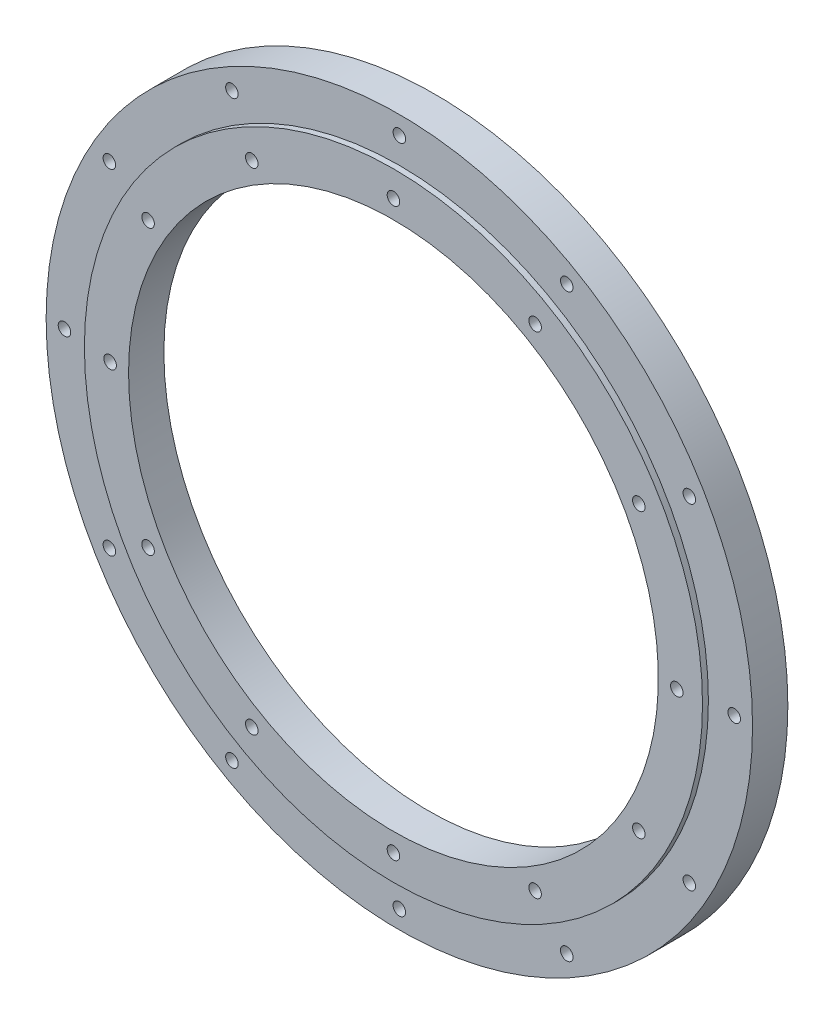
from build123d import *

# Parameters (mm, degrees)
SKETCH2_R             = 76.2
SKETCH2_R_2           = 66.675
BOSS_EXTRUDE1_DEPTH   = 7.62
BOSS_EXTRUDE2_START   = 1.27
SKETCH2_3_R           = 66.675
SKETCH2_3_R_2         = 57.15
BOSS_EXTRUDE2_DEPTH   = 7.62
F_6_32_TAPPED_HOLE1_D = 2.7051
F_6_32_TAPPED_HOLE2_D = 2.7051


with BuildPart() as part:
    # Sketch2 → Boss-Extrude1 (new body)
    with BuildSketch(Plane.XY):
        Circle(SKETCH2_R)
        Circle(SKETCH2_R_2, mode=Mode.SUBTRACT)
    extrude(amount=BOSS_EXTRUDE1_DEPTH)

    # Sketch2<3> → Boss-Extrude2 (add)
    with BuildSketch(Plane.XY.offset(BOSS_EXTRUDE2_START)):
        Circle(SKETCH2_3_R)
        Circle(SKETCH2_3_R_2, mode=Mode.SUBTRACT)
    extrude(amount=BOSS_EXTRUDE2_DEPTH)

    # #6-32 Tapped Hole1 (through all)
    with Locations(Plane(origin=(-30.56255, 52.935889409, 8.89), x_dir=(1, 0, 0), z_dir=(0, 0, 1))):
        with Locations((0, 0), (-22.373339409, -22.373339409), (-30.56255, -52.935889409), (-22.373339409, -83.498439409), (0, -105.871778818), (30.56255, -114.060989409), (61.1251, -105.871778818), (83.498439409, -83.498439409), (91.68765, -52.935889409), (83.498439409, -22.373339409), (61.1251, 0), (30.56255, 8.189210591)):
            Hole(F_6_32_TAPPED_HOLE1_D / 2)

    # #6-32 Tapped Hole2 (through all)
    with Locations(Plane(origin=(0, 72.2376, 7.62), x_dir=(1, 0, 0), z_dir=(0, 0, 1))):
        with Locations((0, 0), (-36.1188, -9.678003292), (-62.559596708, -36.1188), (-72.2376, -72.2376), (-62.559596708, -108.3564), (-36.1188, -134.797196708), (0, -144.4752), (36.1188, -134.797196708), (62.559596708, -108.3564), (72.2376, -72.2376), (62.559596708, -36.1188), (36.1188, -9.678003292)):
            Hole(F_6_32_TAPPED_HOLE2_D / 2)


solid = part.part
